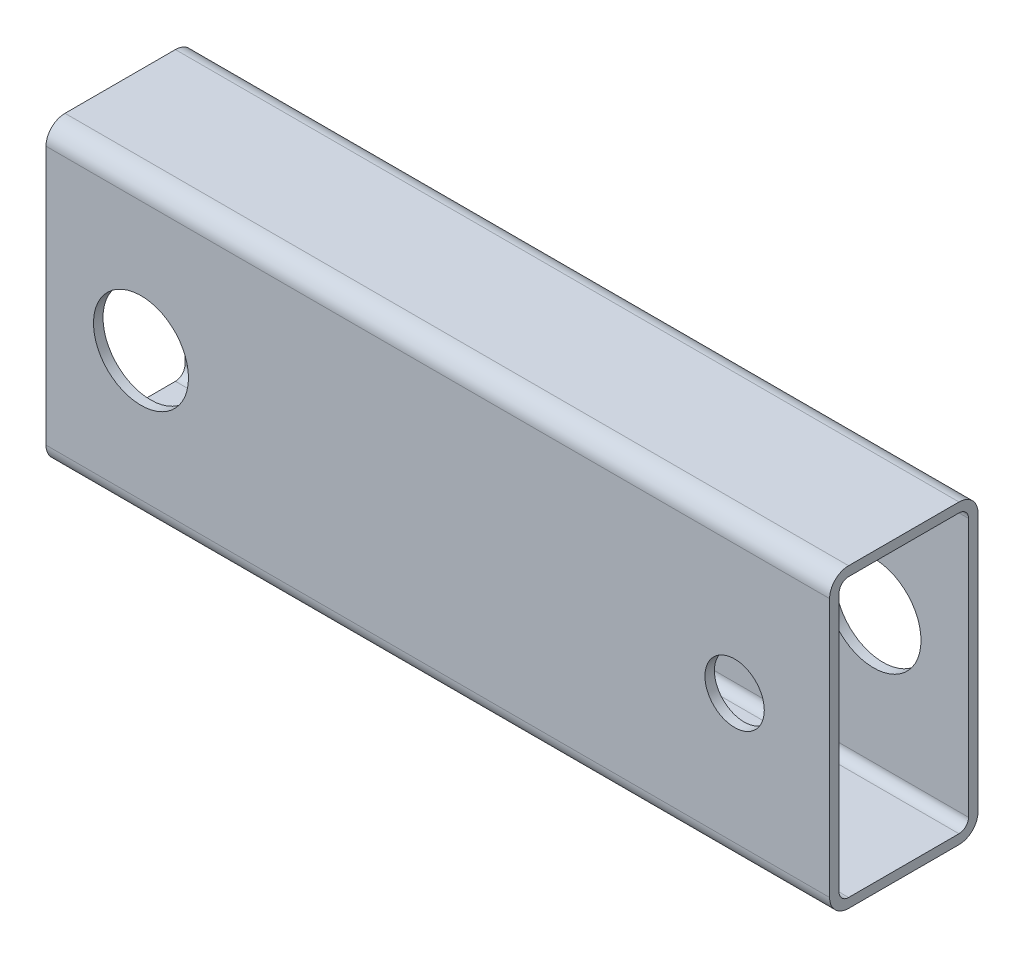
from build123d import *

# Parameters (mm, degrees)
RECTANGULAR_TUBE_2_50_X_25_X_1_6_1_DEPTH = 132
SKETCH2_R                                = 5
CUT_EXTRUDE1_DEPTH                       = 137.65284483
SKETCH2_3_R                              = 8
SKETCH2_3_R_2                            = 5
CUT_EXTRUDE2_DEPTH                       = 1.6
CUT_EXTRUDE5_START                       = -23.4
SKETCH2_4_R                              = 8
SKETCH2_4_R_2                            = 5
CUT_EXTRUDE5_DEPTH                       = 1.6


with BuildPart() as part:
    # Sketch14 → Rectangular tube 2 50 X 25 X 1.6(1) (new body)
    with BuildSketch(Plane(origin=(0, 0, 0), x_dir=(0, 0, -1), z_dir=(1, 0, 0))):
        with BuildLine():
            Line((-9.3, -25), (9.3, -25))
            ThreePointArc((9.3, -25), (11.5627417, -24.0627417), (12.5, -21.8))
            Line((12.5, -21.8), (12.5, 21.8))
            ThreePointArc((12.5, 21.8), (11.5627417, 24.0627417), (9.3, 25))
            Line((9.3, 25), (-9.3, 25))
            ThreePointArc((-9.3, 25), (-11.5627417, 24.0627417), (-12.5, 21.8))
            Line((-12.5, 21.8), (-12.5, -21.8))
            ThreePointArc((-12.5, -21.8), (-11.5627417, -24.0627417), (-9.3, -25))
        make_face()
        with BuildLine():
            Line((-9.3, -23.4), (9.3, -23.4))
            ThreePointArc((9.3, -23.4), (10.43137085, -22.93137085), (10.9, -21.8))
            Line((10.9, -21.8), (10.9, 21.8))
            ThreePointArc((10.9, 21.8), (10.43137085, 22.93137085), (9.3, 23.4))
            Line((9.3, 23.4), (-9.3, 23.4))
            ThreePointArc((-9.3, 23.4), (-10.43137085, 22.93137085), (-10.9, 21.8))
            Line((-10.9, 21.8), (-10.9, -21.8))
            ThreePointArc((-10.9, -21.8), (-10.43137085, -22.93137085), (-9.3, -23.4))
        make_face(mode=Mode.SUBTRACT)
    extrude(amount=RECTANGULAR_TUBE_2_50_X_25_X_1_6_1_DEPTH)

    # Sketch2 → Cut-Extrude1 (cut, through all)
    with BuildSketch(Plane.XY.offset(12.5)):
        with Locations((16, 0)):
            Circle(SKETCH2_R)
        with Locations((116, 0)):
            Circle(SKETCH2_R)
    extrude(amount=-CUT_EXTRUDE1_DEPTH, mode=Mode.SUBTRACT)

    # Sketch2<3> → Cut-Extrude2 (cut)
    # profile 1 of 2: a face of its own
    with BuildSketch(Plane.XY.offset(12.5)):
        with Locations((16, 0)):
            Circle(SKETCH2_3_R)
        with Locations((16, 0)):
            Circle(SKETCH2_3_R_2, mode=Mode.SUBTRACT)
    # profile 2 of 2: a face of its own
    with BuildSketch(Plane.XY.offset(12.5)):
        with Locations((16, 0)):
            Circle(SKETCH2_3_R_2)
    extrude(amount=-CUT_EXTRUDE2_DEPTH, mode=Mode.SUBTRACT)

    # Sketch2<4> → Cut-Extrude5 (cut)
    # profile 1 of 2: a face of its own
    with BuildSketch(Plane.XY.offset(12.5).offset(CUT_EXTRUDE5_START)):
        with Locations((116, 0)):
            Circle(SKETCH2_4_R)
        with Locations((116, 0)):
            Circle(SKETCH2_4_R_2, mode=Mode.SUBTRACT)
    # profile 2 of 2: a face of its own
    with BuildSketch(Plane.XY.offset(12.5).offset(CUT_EXTRUDE5_START)):
        with Locations((116, 0)):
            Circle(SKETCH2_4_R_2)
    extrude(amount=-CUT_EXTRUDE5_DEPTH, mode=Mode.SUBTRACT)


solid = part.part
